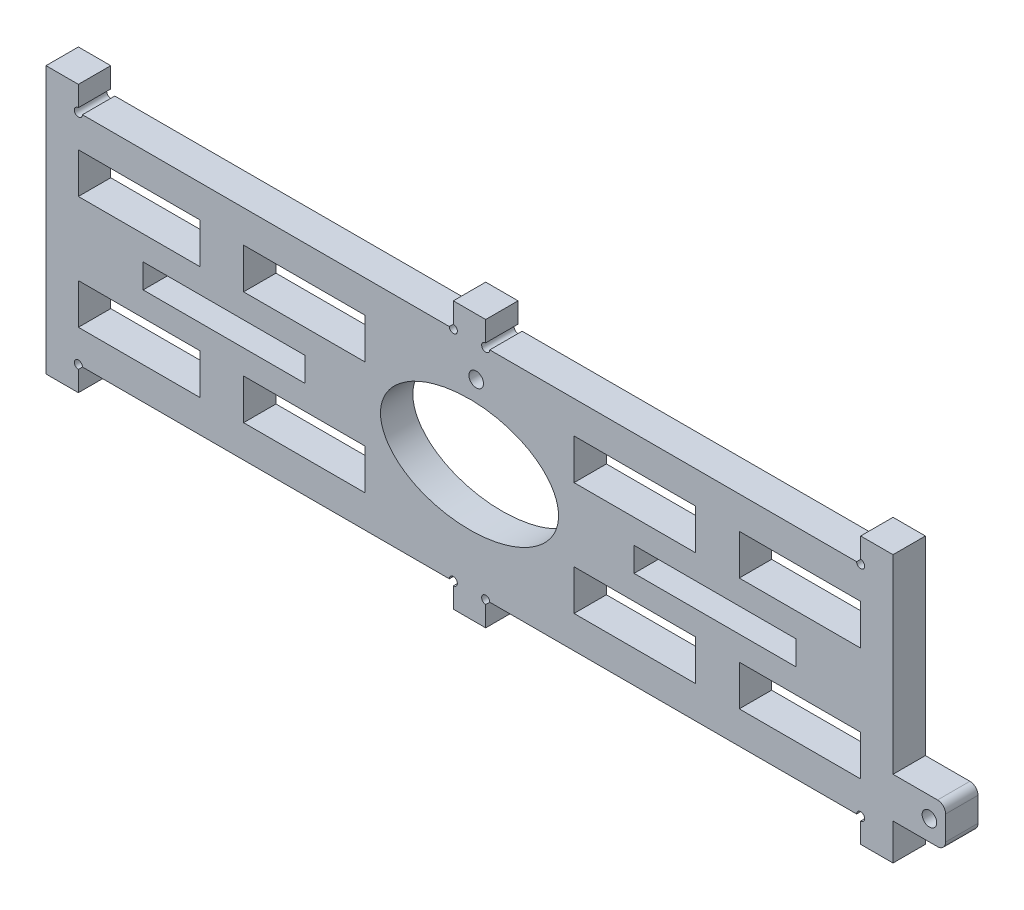
from build123d import *

# Parameters (mm, degrees)
EXTRUDE_2_DEPTH     = 4
SKETCH_3_R          = 0.9
EXTRUDE_3_DEPTH     = 4
SKETCH_4_R          = 0.9
CUT_EXTRUDE_1_DEPTH = 10
SKETCH_5_RX         = 11
SKETCH_5_RY         = 7
SKETCH_5_W          = 15
SKETCH_5_H          = 5
SKETCH_5_W_2        = 20
SKETCH_5_H_2        = 3
CUT_EXTRUDE_2_DEPTH = 10


with BuildPart() as part:
    # 草图2 → 凸台-拉伸2 (new body)
    with BuildSketch(Plane.XY):
        with BuildLine():
            Line((92.360003471, 3.000000026), (46.930000186, 3.000000026))
            ThreePointArc((46.930000186, 3.000000026), (46.076446818, 3.353553971), (46.429999173, 2.499999944))
            Line((46.429999173, 2.499999944), (46.429999173, 0))
            Line((46.429999173, 0), (42.429998517, 0))
            Line((42.429998517, 0), (42.429998517, 2.499999944))
            ThreePointArc((42.429998517, 2.499999944), (42.78355457, 3.35355131), (41.930001229, 3.000000026))
            Line((41.930001229, 3.000000026), (-3.49999981, 3.000000026))
            ThreePointArc((-3.49999981, 3.000000026), (-4.353553201, 3.353553417), (-3.99999981, 2.500000026))
            Line((-3.99999981, 2.500000026), (-3.99999981, 0))
            Line((-3.99999981, 0), (-8, 0))
            Line((-8, 0), (-8, 35.000000149))
            Line((-8, 35.000000149), (-3.99999981, 35.000000149))
            Line((-3.99999981, 35.000000149), (-3.99999981, 32.500000123))
            ThreePointArc((-3.99999981, 32.500000123), (-4.353553201, 31.646446732), (-3.49999981, 32.000000123))
            Line((-3.49999981, 32.000000123), (41.930001229, 32.000000123))
            ThreePointArc((41.930001229, 32.000000123), (42.78355457, 31.646448839), (42.429998517, 32.500000205))
            Line((42.429998517, 32.500000205), (42.429998517, 35.000000149))
            Line((42.429998517, 35.000000149), (46.429999173, 35.000000149))
            Line((46.429999173, 35.000000149), (46.429999173, 32.500000205))
            ThreePointArc((46.429999173, 32.500000205), (46.076446818, 31.646446178), (46.930000186, 32.000000123))
            Line((46.930000186, 32.000000123), (92.360003471, 32.000000123))
            ThreePointArc((92.360003471, 32.000000123), (93.213546668, 31.646450955), (92.8599975, 32.500000123))
            Line((92.8599975, 32.500000123), (92.8599975, 35.000000149))
            Line((92.8599975, 35.000000149), (96.85999769, 35.000000149))
            Line((96.85999769, 35.000000149), (96.85999769, 0))
            Line((96.85999769, 0), (92.8599975, 0))
            Line((92.8599975, 0), (92.8599975, 2.500000026))
            ThreePointArc((92.8599975, 2.500000026), (93.21355089, 3.353553417), (92.360003471, 3.000000026))
        make_face()
    extrude(amount=EXTRUDE_2_DEPTH)


with BuildPart() as body_2:
    # Split Bodies 1: the piece on the far side of the plane
    add(part.part)
    split(bisect_by=Plane.YZ.offset(48.429999172), keep=Keep.BOTTOM)


with BuildPart() as part_1:
    add(part.part)

    # Split Bodies 1
    split(bisect_by=Plane.YZ.offset(48.429999172), keep=Keep.TOP)


with BuildPart() as part_2:
    # Move Body 1: moved
    add(part_1.part.moved(Location((-0.1, 0, 0))))


with BuildPart() as body_3:
    # Split Bodies 2: the piece on the far side of the plane
    add(body_2.part)
    split(bisect_by=Plane(origin=(40.429998517, 0, 0), x_dir=(0, -1, 0), z_dir=(-1, 0, 0)), keep=Keep.BOTTOM)


with BuildPart() as body_2_1:
    add(body_2.part)

    # Split Bodies 2
    split(bisect_by=Plane(origin=(40.429998517, 0, 0), x_dir=(0, -1, 0), z_dir=(-1, 0, 0)), keep=Keep.TOP)


with BuildPart() as body_2_2:
    # Move Body 2: moved
    add(body_2_1.part.moved(Location((0.1, 0, 0))))


with BuildPart() as part_3:
    add(part_2.part)

    # Combine 2: union body 3, body 2
    add(body_3.part)
    add(body_2_2.part)


with BuildPart() as body_2_2_1:
    # Split Bodies 3: the piece on the far side of the plane
    add(part_3.part)
    split(bisect_by=Plane(origin=(0, 27.000000123, 0), x_dir=(1, 0, 0), z_dir=(0, 1, 0)), keep=Keep.BOTTOM)


with BuildPart() as part_4:
    add(part_3.part)

    # Split Bodies 3
    split(bisect_by=Plane(origin=(0, 27.000000123, 0), x_dir=(1, 0, 0), z_dir=(0, 1, 0)), keep=Keep.TOP)


with BuildPart() as part_5:
    # Move Body 3: moved
    add(part_4.part.moved(Location((0, -2, 0))))

    # Combine 3: union body 2 2
    add(body_2_2_1.part)

    # 草图3 → 凸台-拉伸3 (add)
    with BuildSketch(Plane(origin=(0, 0, 0), x_dir=(-1, 0, 0), z_dir=(0, 0, -1))):
        with BuildLine():
            Line((-102.25999769, 9.500000075), (-96.75999769, 9.500000075))
            Line((-96.75999769, 9.500000075), (-96.75999769, 4.500000075))
            Line((-96.75999769, 4.500000075), (-102.25999769, 4.500000074))
            ThreePointArc((-102.25999769, 4.500000074), (-102.967104471, 4.792893293), (-103.25999769, 5.500000074))
            Line((-103.25999769, 5.500000074), (-103.25999769, 8.500000075))
            ThreePointArc((-103.25999769, 8.500000075), (-102.967104471, 9.207106856), (-102.25999769, 9.500000075))
        make_face()
        with Locations((-101.25999769, 7.000000075)):
            Circle(SKETCH_3_R, mode=Mode.SUBTRACT)
    extrude(amount=-EXTRUDE_3_DEPTH)

    # 草图4 → 切除-拉伸1 (cut)
    with BuildSketch(Plane(origin=(0, 0, 0), x_dir=(-1, 0, 0), z_dir=(0, 0, -1))):
        with Locations((-45.25999769, 26.000000075)):
            Circle(SKETCH_4_R)
    extrude(amount=-CUT_EXTRUDE_1_DEPTH, mode=Mode.SUBTRACT)

    # 草图5 → 切除-拉伸2 (cut)
    with BuildSketch(Plane(origin=(0, 0, 0), x_dir=(-1, 0, 0), z_dir=(0, 0, -1))):
        with Locations((-44.429998845, 16.500000074)):
            Ellipse(SKETCH_5_RX, SKETCH_5_RY)
        with Locations((-85.25999769, 23.500000123)):
            Rectangle(SKETCH_5_W, SKETCH_5_H)
        with Locations((-64.844998267, 23.500000123)):
            Rectangle(SKETCH_5_W, SKETCH_5_H)
        with Locations((-24.014999422, 23.500000123)):
            Rectangle(SKETCH_5_W, SKETCH_5_H)
        with Locations((-3.6, 23.500000123)):
            Rectangle(SKETCH_5_W, SKETCH_5_H)
        with Locations((-3.6, 9.500000026)):
            Rectangle(SKETCH_5_W, SKETCH_5_H)
        with Locations((-24.014999422, 9.500000026)):
            Rectangle(SKETCH_5_W, SKETCH_5_H)
        with Locations((-64.844998267, 9.500000026)):
            Rectangle(SKETCH_5_W, SKETCH_5_H)
        with Locations((-85.25999769, 9.500000026)):
            Rectangle(SKETCH_5_W, SKETCH_5_H)
        with Locations((-74.75999769, 16.500000123)):
            Rectangle(SKETCH_5_W_2, SKETCH_5_H_2)
        with Locations((-14.1, 16.500000123)):
            Rectangle(SKETCH_5_W_2, SKETCH_5_H_2)
    extrude(amount=-CUT_EXTRUDE_2_DEPTH, mode=Mode.SUBTRACT)


solid = part_5.part
